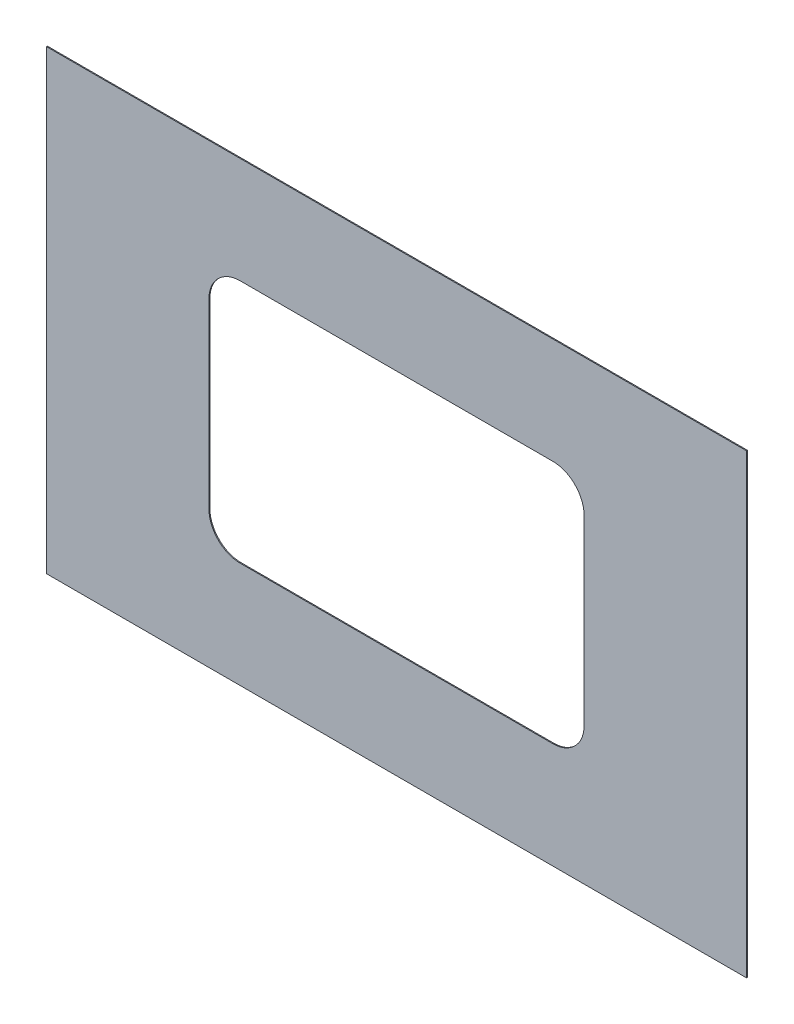
from build123d import *

# Parameters (mm, degrees)
SKETCH1_W           = 1120
SKETCH1_H           = 730
BOSS_EXTRUDE2_DEPTH = 1.5


with BuildPart() as part:
    # Sketch1 → Boss-Extrude2 (new body)
    with BuildSketch(Plane.XY):
        Rectangle(SKETCH1_W, SKETCH1_H)
        with BuildLine():
            Line((250, 195.535714286), (-250, 195.535714286))
            ThreePointArc((-250, 195.535714286), (-285.355339059, 180.891053345), (-300, 145.535714286))
            Line((-300, 145.535714286), (-300, -145.535714286))
            ThreePointArc((-300, -145.535714286), (-285.355339059, -180.891053345), (-250, -195.535714286))
            Line((-250, -195.535714286), (250, -195.535714286))
            ThreePointArc((250, -195.535714286), (285.355339059, -180.891053345), (300, -145.535714286))
            Line((300, -145.535714286), (300, 145.535714286))
            ThreePointArc((300, 145.535714286), (285.355339059, 180.891053345), (250, 195.535714286))
        make_face(mode=Mode.SUBTRACT)
    extrude(amount=BOSS_EXTRUDE2_DEPTH)


solid = part.part
